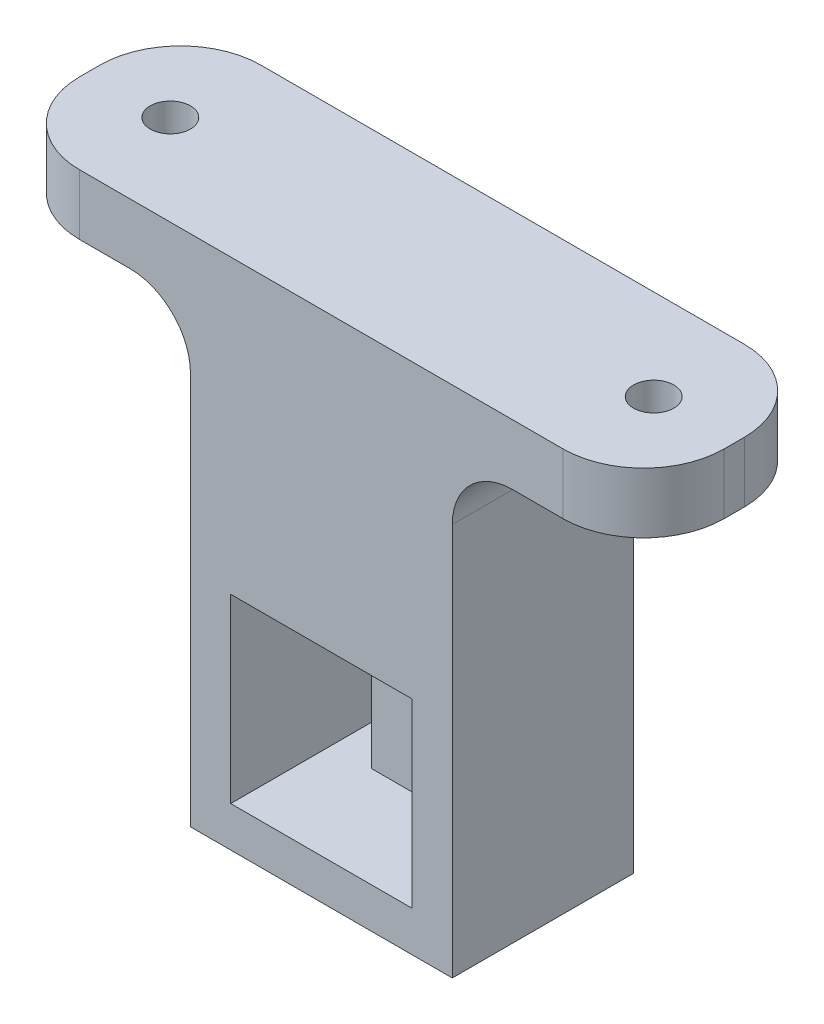
from build123d import *

# Parameters (mm, degrees)
SKETCH1_W           = 13
SKETCH1_H           = 13
SKETCH1_W_2         = 5
SKETCH1_H_2         = 9
BOSS_EXTRUDE1_DEPTH = 4
SKETCH2_W           = 13
SKETCH2_H           = 13
SKETCH2_W_2         = 9
SKETCH2_H_2         = 9
BOSS_EXTRUDE2_DEPTH = 5
SKETCH3_W           = 13
SKETCH3_H           = 9
BOSS_EXTRUDE3_DEPTH = 12.5
BOSS_EXTRUDE4_DEPTH = 3
FILLET1_R           = 3
SKETCH5_R           = 1
CUT_EXTRUDE1_DEPTH  = 43.264050918


with BuildPart() as part:
    # Sketch1 → Boss-Extrude1 (new body)
    # profile 1 of 2: a face of its own
    with BuildSketch(Plane(origin=(0, 0, -28), x_dir=(-1, 0, 0), z_dir=(0, 0, -1))):
        with Locations((0, 6)):
            Rectangle(SKETCH1_W, SKETCH1_H)
        Polygon((-4.5, 10.5), (-2.5, 10.5), (2.5, 10.5), (4.5, 10.5), (4.5, 1.5), (2.5, 1.5), (-2.5, 1.5), (-4.5, 1.5), align=None, mode=Mode.SUBTRACT)
    # profile 2 of 2: a face of its own
    with BuildSketch(Plane(origin=(0, 0, -28), x_dir=(-1, 0, 0), z_dir=(0, 0, -1))):
        with Locations((0, 6)):
            Rectangle(SKETCH1_W_2, SKETCH1_H_2)
    extrude(amount=BOSS_EXTRUDE1_DEPTH)

    # Sketch2 → Boss-Extrude2 (add)
    with BuildSketch(Plane.XY.offset(-28)):
        with Locations((0, 6)):
            Rectangle(SKETCH2_W, SKETCH2_H)
        with Locations((0, 6)):
            Rectangle(SKETCH2_W_2, SKETCH2_H_2, mode=Mode.SUBTRACT)
    extrude(amount=BOSS_EXTRUDE2_DEPTH)

    # Sketch3 → Boss-Extrude3 (add)
    with BuildSketch(Plane(origin=(0, 12.5, 0), x_dir=(1, 0, 0), z_dir=(0, 1, 0))):
        with Locations((0, 27.5)):
            Rectangle(SKETCH3_W, SKETCH3_H)
    extrude(amount=BOSS_EXTRUDE3_DEPTH)

    # Sketch4 → Boss-Extrude4 (add)
    with BuildSketch(Plane(origin=(0, 25, 0), x_dir=(1, 0, 0), z_dir=(0, 1, 0))):
        with BuildLine():
            Line((-12, 23), (12, 23))
            ThreePointArc((12, 23), (14.828427125, 24.171572875), (16, 27))
            Line((16, 27), (16, 28))
            ThreePointArc((16, 28), (14.828427125, 30.828427125), (12, 32))
            Line((12, 32), (-12, 32))
            ThreePointArc((-12, 32), (-14.828427125, 30.828427125), (-16, 28))
            Line((-16, 28), (-16, 27))
            ThreePointArc((-16, 27), (-14.828427125, 24.171572875), (-12, 23))
        make_face()
    extrude(amount=-BOSS_EXTRUDE4_DEPTH)

    # Fillet1
    fillet1_edges = [part.edges().sort_by_distance(p)[0] for p in [
        (-6.5, 22, -27.5),
        (6.5, 22, -27.5),
    ]]
    fillet(fillet1_edges, radius=FILLET1_R)

    # Sketch5 → Cut-Extrude1 (cut, through all)
    with BuildSketch(Plane.XZ.offset(-22)):
        with Locations((-12, -27.5)):
            Circle(SKETCH5_R)
        with Locations((12, -27.5)):
            Circle(SKETCH5_R)
    extrude(amount=-CUT_EXTRUDE1_DEPTH, mode=Mode.SUBTRACT)


solid = part.part
